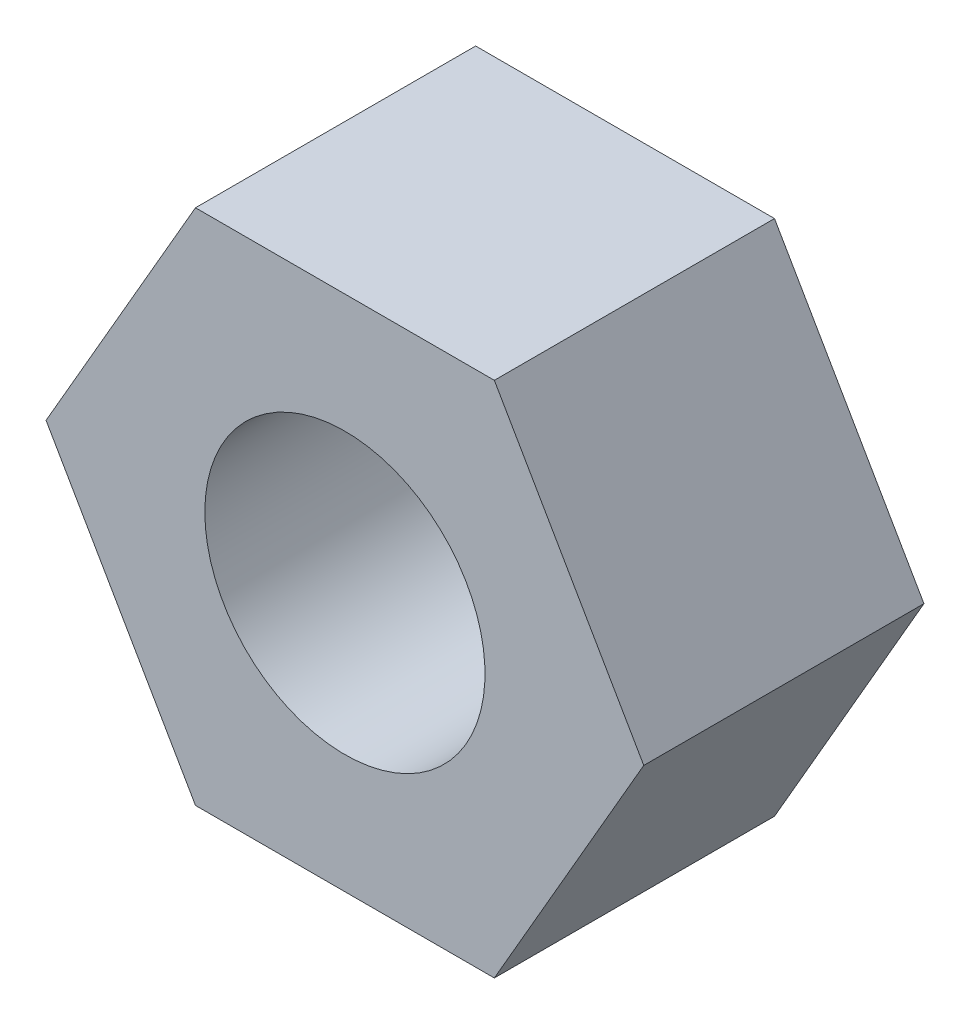
from build123d import *

# Parameters (mm, degrees)
EXTRUDE_1_DEPTH     = 3
SKETCH_2_R          = 1.5
CUT_EXTRUDE_1_DEPTH = 3


with BuildPart() as part:
    # 草图1 → 凸台-拉伸1 (new body)
    with BuildSketch(Plane.XY):
        Polygon((1.6, 2.771281292), (-1.6, 2.771281292), (-3.2, 0), (-1.6, -2.771281292), (1.6, -2.771281292), (3.2, 0), align=None)
    extrude(amount=EXTRUDE_1_DEPTH)

    # 草图2 → 切除-拉伸1 (cut)
    with BuildSketch(Plane(origin=(0, 0, 0), x_dir=(-1, 0, 0), z_dir=(0, 0, -1))):
        Circle(SKETCH_2_R)
    extrude(amount=-CUT_EXTRUDE_1_DEPTH, mode=Mode.SUBTRACT)


solid = part.part
